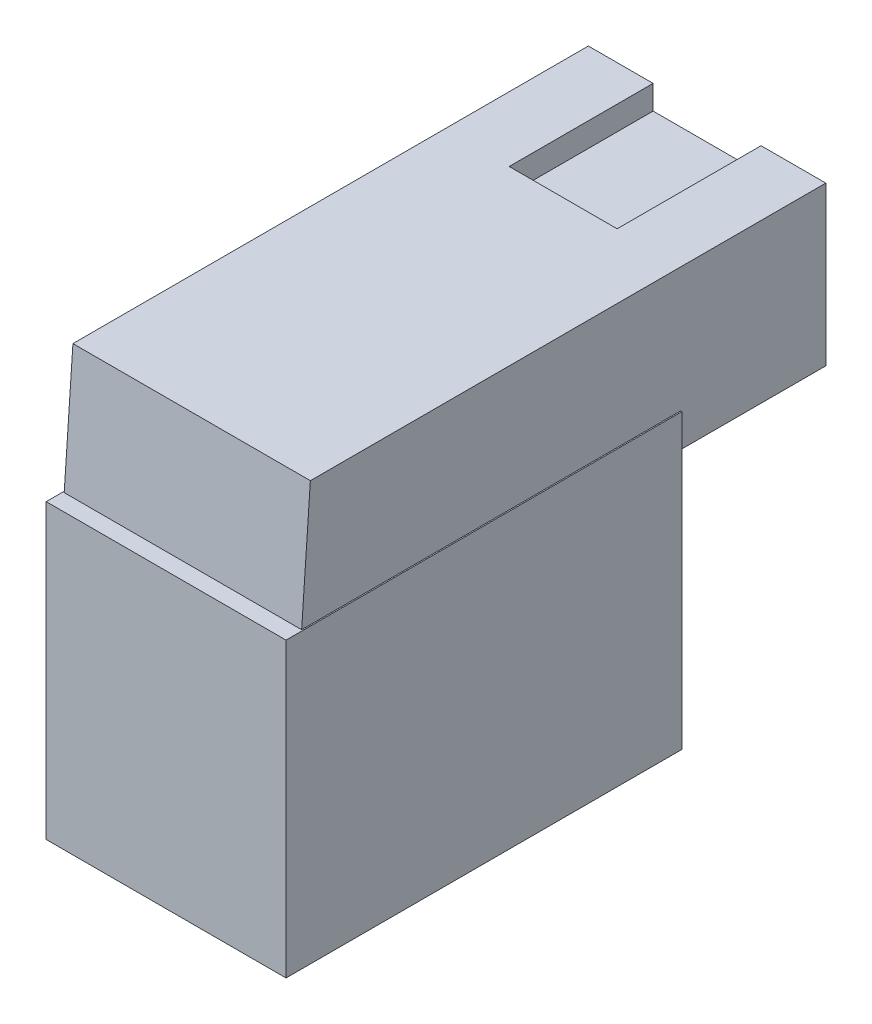
from build123d import *

# Parameters (mm, degrees)
SKETCH1_W       = 10
SKETCH1_H       = 16.5
MAIN_BODY_DEPTH = 12.2
M_BASE_DEPTH    = 4.95
SKETCH12_W      = 4.5
SKETCH12_H      = 1
MO_CUT_1_DEPTH  = 6
SKETCH13_W      = 1
SKETCH13_H      = 1
MO_PINS_DEPTH   = 5


with BuildPart() as part:
    # Sketch1 → Main_Body (new body)
    with BuildSketch(Plane(origin=(0, 0, 0), x_dir=(1, 0, 0), z_dir=(0, 1, 0))):
        with Locations((0, 8.25)):
            Rectangle(SKETCH1_W, SKETCH1_H)
    extrude(amount=MAIN_BODY_DEPTH)

    # Sketch11 → M_Base (add, symmetric)
    with BuildSketch(Plane(origin=(0, 0, 0), x_dir=(0, 0, -1), z_dir=(1, 0, 0))):
        Polygon((0.7, 12.2), (1.063619422, 17.4), (22.553619422, 17.4), (22.553619422, 10.8), (16.5, 10.8), (16.5, 12.2), align=None)
    extrude(amount=M_BASE_DEPTH, both=True)

    # Sketch12 → MO_Cut_1 (cut)
    with BuildSketch(Plane(origin=(0, 0, -22.553619422), x_dir=(-1, 0, 0), z_dir=(0, 0, -1))):
        with Locations((0, 16.9)):
            Rectangle(SKETCH12_W, SKETCH12_H)
        Polygon((-3.45, 15.1), (3.45, 15.1), (3.45, 13.6), (2.9, 13.6), (2.9, 11.9), (-2.9, 11.9), (-2.9, 13.6), (-3.45, 13.6), align=None)
    extrude(amount=-MO_CUT_1_DEPTH, mode=Mode.SUBTRACT)

    # Sketch13 → MO_Pins (add)
    with BuildSketch(Plane(origin=(0, 0, -16.553619422), x_dir=(-1, 0, 0), z_dir=(0, 0, -1))):
        with Locations((-1.25, 13.8)):
            Rectangle(SKETCH13_W, SKETCH13_H)
        with Locations((1.25, 13.8)):
            Rectangle(SKETCH13_W, SKETCH13_H)
    extrude(amount=MO_PINS_DEPTH)


solid = part.part
